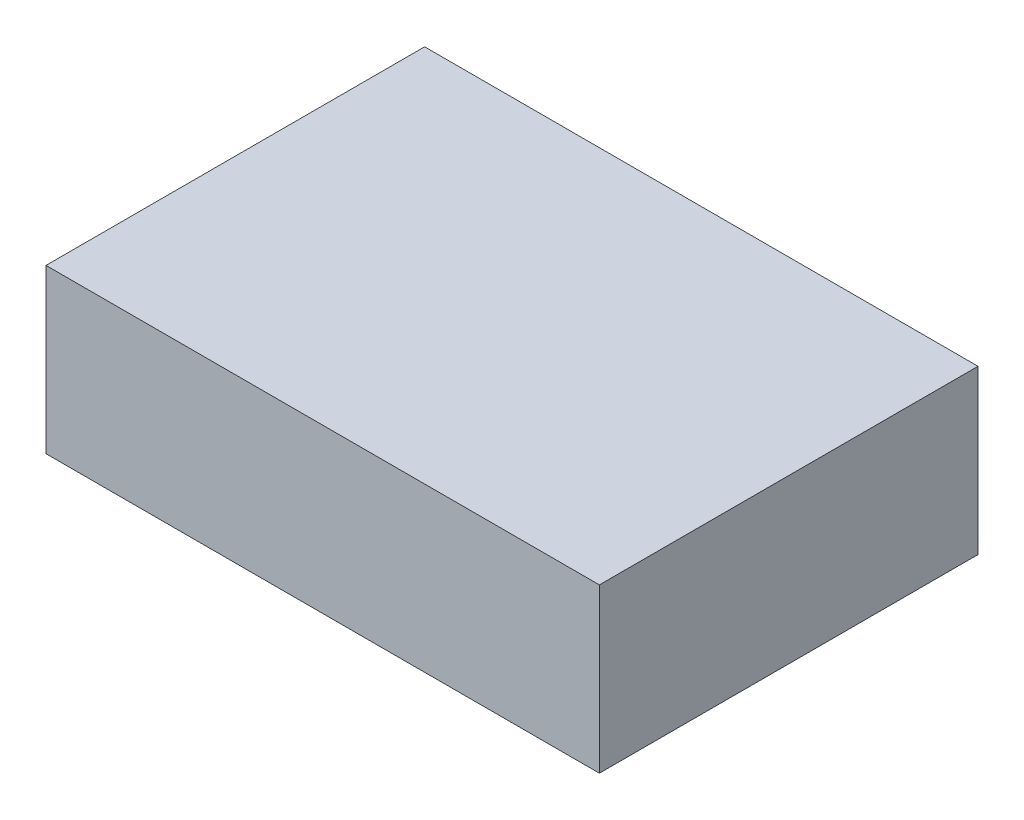
from build123d import *

# Parameters (mm, degrees)
SKETCH1_W           = 60.325
SKETCH1_H           = 41.275
BOSS_EXTRUDE1_DEPTH = 17.78


with BuildPart() as part:
    # Sketch1 → Boss-Extrude1 (new body)
    with BuildSketch(Plane(origin=(0, 0, 0), x_dir=(1, 0, 0), z_dir=(0, 1, 0))):
        with Locations((30.1625, 20.6375)):
            Rectangle(SKETCH1_W, SKETCH1_H)
    extrude(amount=BOSS_EXTRUDE1_DEPTH)


solid = part.part
